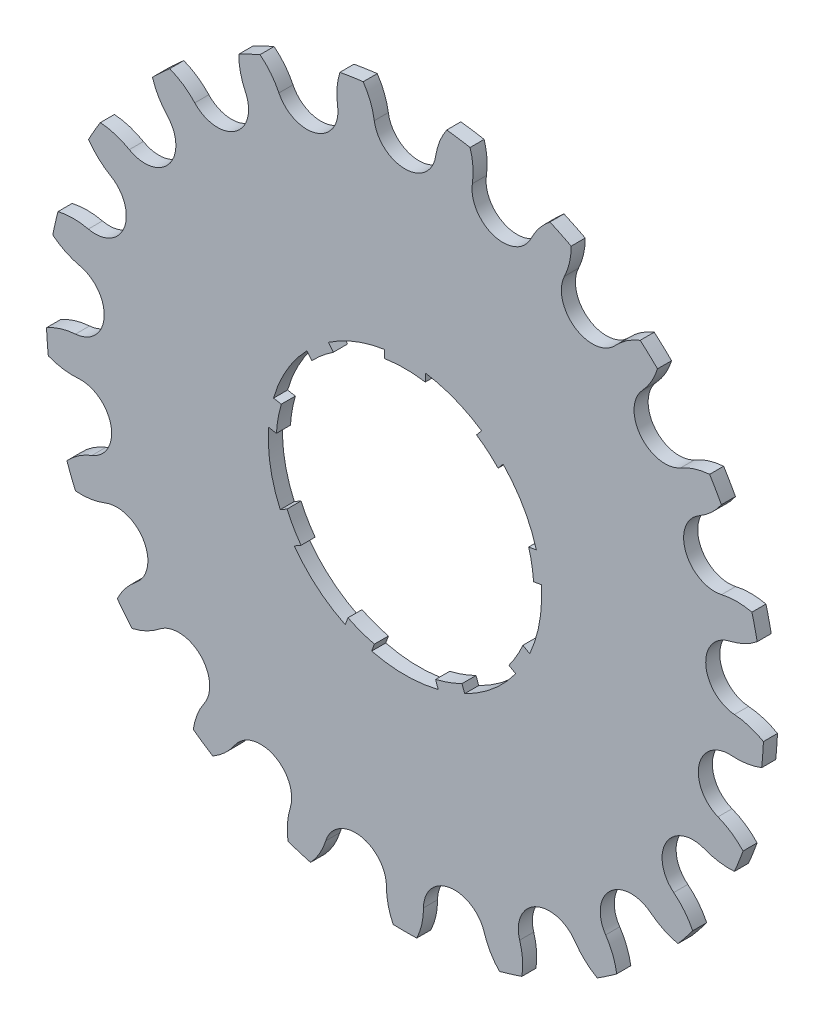
from build123d import *

# Parameters (mm, degrees)
SK_DISCO_R           = 45.939497274
DISCO_DEPTH          = 1.8
HUECO_DIENTE_DEPTH   = 65.993190563
MATRIZ_DIENTES_COUNT = 21


with BuildPart() as part:
    # Sk_Disco → Disco (new body)
    with BuildSketch(Plane.XY):
        Circle(SK_DISCO_R)
        with BuildLine():
            Line((2.6, 17.305779381), (2.6, 16.293863876))
            ThreePointArc((2.6, 16.293863876), (0, 16.5), (-2.6, 16.293863876))
            Line((-2.6, 16.293863876), (-2.6, 17.305779381))
            ThreePointArc((-2.6, 17.305779381), (-6.362648192, 16.302352836), (-9.810241185, 14.491693065))
            Line((-9.810241185, 14.491693065), (-9.163816615, 13.721314261))
            ThreePointArc((-9.163816615, 13.721314261), (-10.60599556, 12.639733311), (-11.92157661, 11.407278866))
            Line((-11.92157661, 11.407278866), (-12.56800118, 12.17765767))
            ThreePointArc((-12.56800118, 12.17765767), (-15.155444566, 8.75), (-16.830161491, 4.795379462))
            Line((-16.830161491, 4.795379462), (-15.839781591, 4.620748764))
            ThreePointArc((-15.839781591, 4.620748764), (-16.249327925, 2.865194932), (-16.464915031, 1.075440854))
            Line((-16.464915031, 1.075440854), (-17.455294931, 1.250071551))
            ThreePointArc((-17.455294931, 1.250071551), (-17.234135678, -3.038843109), (-15.975062189, -7.144745486))
            Line((-15.975062189, -7.144745486), (-15.104136721, -6.641916433))
            ThreePointArc((-15.104136721, -6.641916433), (-14.289419162, -8.25), (-13.304136721, -9.759607887))
            Line((-13.304136721, -9.759607887), (-14.175062189, -10.26243694))
            ThreePointArc((-14.175062189, -10.26243694), (-11.24878317, -13.405777755), (-7.645053746, -15.741764616))
            Line((-7.645053746, -15.741764616), (-7.301098416, -14.796755115))
            ThreePointArc((-7.301098416, -14.796755115), (-5.643332365, -15.504928243), (-3.918204981, -16.028027631))
            Line((-3.918204981, -16.028027631), (-4.262160311, -16.973037132))
            ThreePointArc((-4.262160311, -16.973037132), (0, -17.5), (4.262160311, -16.973037132))
            Line((4.262160311, -16.973037132), (3.918204981, -16.028027631))
            ThreePointArc((3.918204981, -16.028027631), (5.643332365, -15.504928243), (7.301098416, -14.796755115))
            Line((7.301098416, -14.796755115), (7.645053746, -15.741764616))
            ThreePointArc((7.645053746, -15.741764616), (11.24878317, -13.405777755), (14.175062189, -10.26243694))
            Line((14.175062189, -10.26243694), (13.304136721, -9.759607887))
            ThreePointArc((13.304136721, -9.759607887), (14.289419162, -8.25), (15.104136721, -6.641916433))
            Line((15.104136721, -6.641916433), (15.975062189, -7.144745486))
            ThreePointArc((15.975062189, -7.144745486), (17.234135678, -3.038843109), (17.455294931, 1.250071551))
            Line((17.455294931, 1.250071551), (16.464915031, 1.075440854))
            ThreePointArc((16.464915031, 1.075440854), (16.249327925, 2.865194932), (15.839781591, 4.620748764))
            Line((15.839781591, 4.620748764), (16.830161491, 4.795379462))
            ThreePointArc((16.830161491, 4.795379462), (15.155444566, 8.75), (12.56800118, 12.17765767))
            Line((12.56800118, 12.17765767), (11.92157661, 11.407278866))
            ThreePointArc((11.92157661, 11.407278866), (10.60599556, 12.639733311), (9.163816615, 13.721314261))
            Line((9.163816615, 13.721314261), (9.810241185, 14.491693065))
            ThreePointArc((9.810241185, 14.491693065), (6.362648192, 16.302352836), (2.6, 17.305779381))
        make_face(mode=Mode.SUBTRACT)
    extrude(amount=DISCO_DEPTH)

    # Sk_Hueco → Hueco_diente (cut, through all)
    with BuildSketch(Plane.XY):
        with BuildLine():
            ThreePointArc((-3.930602534, 42.01292098), (0, 38.630363988), (3.930602534, 42.01292098))
            ThreePointArc((3.930602534, 42.01292098), (4.960257024, 45.001772437), (6.987328103, 47.427551537))
            ThreePointArc((6.987328103, 47.427551537), (0, 47.939497274), (-6.987328103, 47.427551537))
            ThreePointArc((-6.987328103, 47.427551537), (-4.960257024, 45.001772437), (-3.930602534, 42.01292098))
        make_face()
    hueco_diente = extrude(amount=HUECO_DIENTE_DEPTH, mode=Mode.SUBTRACT)

    # Matriz_dientes: Hueco_diente ×21 about axis
    matriz_dientes_axis = Axis((0, 0, -0.09), (0, 0, 1))
    for i in range(1, MATRIZ_DIENTES_COUNT):
        add(hueco_diente.rotate(matriz_dientes_axis, i * 360 / MATRIZ_DIENTES_COUNT), mode=Mode.SUBTRACT)


solid = part.part
